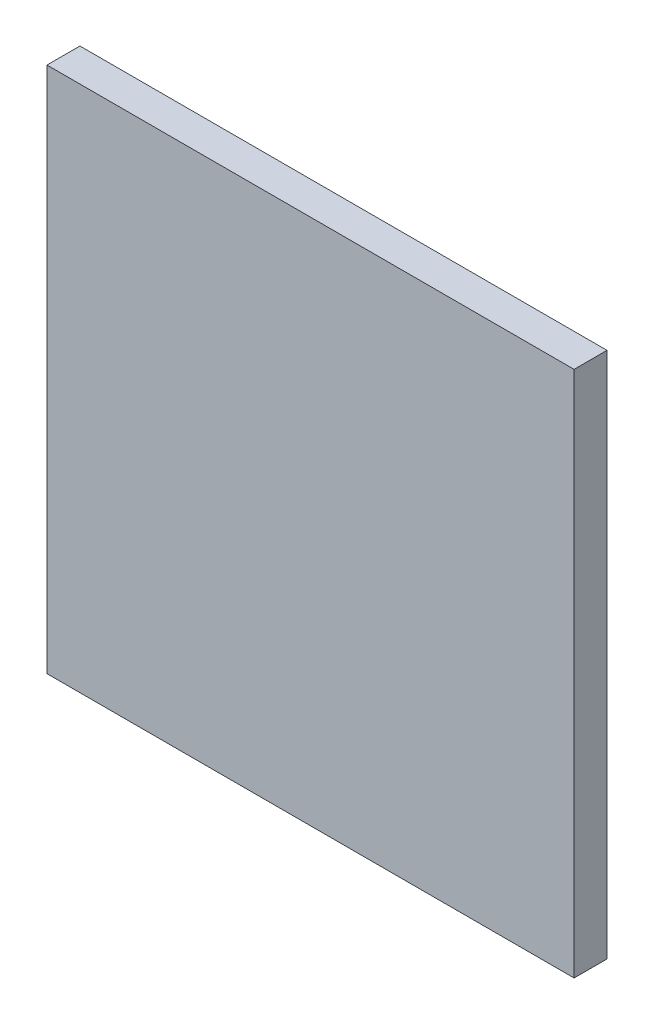
from build123d import *

# Parameters (mm, degrees)
SKETCH1_W           = 25.4
SKETCH1_H           = 25.4
BOSS_EXTRUDE1_DEPTH = 1.5875


with BuildPart() as part:
    # Sketch1 → Boss-Extrude1 (new body)
    with BuildSketch(Plane.XY):
        with Locations((12.7, 12.7)):
            Rectangle(SKETCH1_W, SKETCH1_H)
    extrude(amount=BOSS_EXTRUDE1_DEPTH)


solid = part.part
